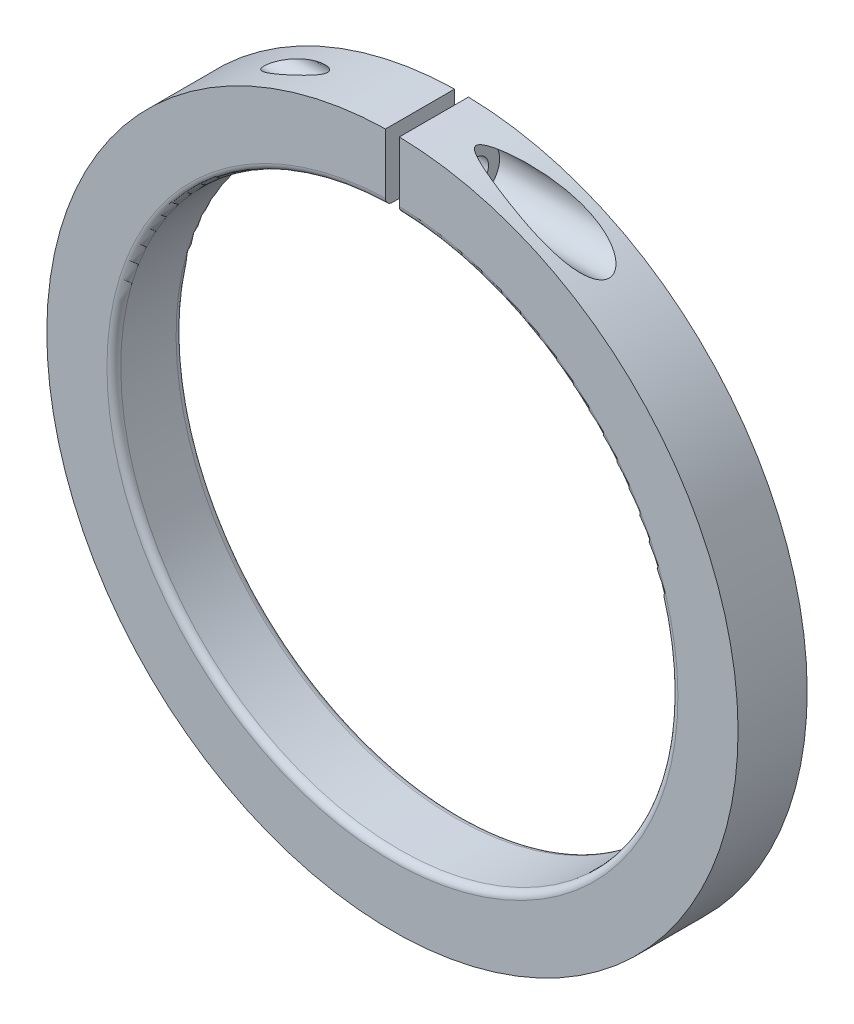
from build123d import *

# Parameters (mm, degrees)
SKETCH2_R               = 25
SKETCH2_R_2             = 20.15
BOSS_EXTRUDE1_DEPTH     = 5
SKETCH3_W               = 1
SKETCH3_H               = 60
CUT_EXTRUDE1_DEPTH      = 5
CUT_EXTRUDE2_DEPTH      = 36.707142143
CUT_EXTRUDE2_DEPTH_BACK = 36.707142143
SKETCH4_R               = 0.95
CUT_EXTRUDE3_DEPTH      = 44.301270339
CUT_EXTRUDE3_DEPTH_BACK = 6.5
SKETCH6_R               = 1.75
FILLET1_R               = 0.5


with BuildPart() as part:
    # Sketch2 → Boss-Extrude1 (new body)
    with BuildSketch(Plane.XY):
        Circle(SKETCH2_R)
        Circle(SKETCH2_R_2, mode=Mode.SUBTRACT)
    extrude(amount=BOSS_EXTRUDE1_DEPTH)

    # Sketch3 → Cut-Extrude1 (cut)
    with BuildSketch(Plane.XY.offset(5)):
        with Locations((0, 30)):
            Rectangle(SKETCH3_W, SKETCH3_H)
    extrude(amount=-CUT_EXTRUDE1_DEPTH, mode=Mode.SUBTRACT)

    # Sketch4 → Cut-Extrude2 (cut, two sides: drawn at the far end of the back side and taken through both)
    with BuildSketch(Plane(origin=(0, 0, 0), x_dir=(0, 0, -1), z_dir=(1, 0, 0)).offset(-CUT_EXTRUDE2_DEPTH_BACK)):
        with Locations((-2.5, 22.9949995)):
            Circle(SKETCH4_R)
    extrude(amount=CUT_EXTRUDE2_DEPTH + CUT_EXTRUDE2_DEPTH_BACK, mode=Mode.SUBTRACT)

    # Sketch6 → Cut-Extrude3 (cut, two sides: drawn at the far end of the back side and taken through both)
    with BuildSketch(Plane(origin=(10, 0, 0), x_dir=(0, 0, -1), z_dir=(1, 0, 0)).offset(-CUT_EXTRUDE3_DEPTH_BACK)):
        with Locations(Location((-2.5, 22.9949995, 0), (0, 0, 180))):
            Circle(SKETCH6_R)
    extrude(amount=CUT_EXTRUDE3_DEPTH + CUT_EXTRUDE3_DEPTH_BACK, mode=Mode.SUBTRACT)

    # Fillet1
    fillet1_edges = [part.edges().sort_by_distance(p)[0] for p in [
        (-14.070314495, -14.423895105, 5),
        (-14.070314495, -14.423895105, 0),
    ]]
    fillet(fillet1_edges, radius=FILLET1_R)


solid = part.part
